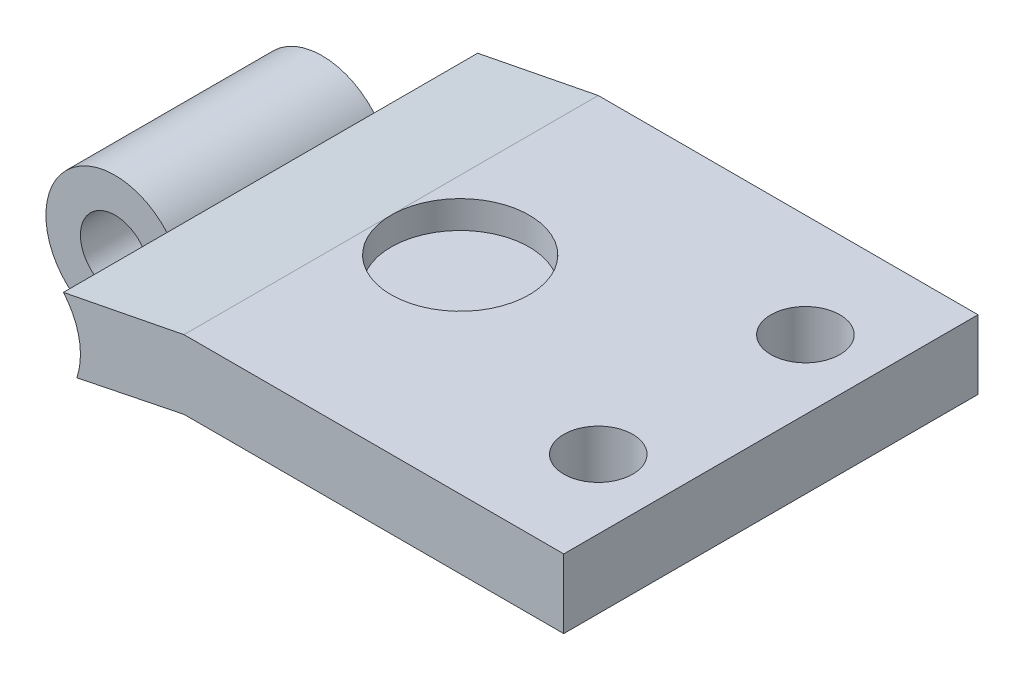
from build123d import *

# Parameters (mm, degrees)
Y_KSEKLIK_EKSTR_ZYON1_DEPTH = 30
KES_EKSTR_ZYON1_START       = -30
IZIM2_R                     = 2.5
KES_EKSTR_ZYON1_DEPTH       = 30
KES_EKSTR_ZYON3_START       = -7.5
IZIM6_R                     = 5
KES_EKSTR_ZYON3_DEPTH       = 7.5
IZIM7_R                     = 5
KES_EKSTR_ZYON4_DEPTH       = 7.5
IZIM9_R                     = 5
KES_EKSTR_ZYON6_DEPTH       = 2
IZIM10_R                    = 2.5
KES_EKSTR_ZYON7_DEPTH       = 5


with BuildPart() as part:
    # Çizim1 → Yükseklik-Ekstrüzyon1 (new body)
    with BuildSketch(Plane.XY):
        with BuildLine():
            Line((-25.050567114, 3.343092307), (-16.318399297, 5.056233526))
            Line((-16.318399297, 5.056233526), (3.922819568, 5.056233526))
            Line((3.922819568, 5.056233526), (6.182819568, 5.056233526))
            Line((6.182819568, 5.056233526), (11.182819568, 5.056233526))
            Line((11.182819568, 5.056233526), (11.182819568, 0.056233526))
            Line((11.182819568, 0.056233526), (6.182819568, 0.056233526))
            Line((6.182819568, 0.056233526), (3.922819568, 0.056233526))
            Line((3.922819568, 0.056233526), (-16.318399297, 0.056233526))
            Line((-16.318399297, 0.056233526), (-24.07574143, -1.527179355))
            ThreePointArc((-24.07574143, -1.527179355), (-33.721153292, -0.925093769), (-25.050567114, 3.343092307))
        make_face()
        with BuildLine():
            Line((-28.337105741, -2.397000362), (-28.299750993, -2.389375587))
            ThreePointArc((-28.299750993, -2.389375587), (-28.318413832, -2.393259183), (-28.337105741, -2.397000362))
        make_face(mode=Mode.SUBTRACT)
    extrude(amount=Y_KSEKLIK_EKSTR_ZYON1_DEPTH)

    # Çizim2 → Kes-Ekstrüzyon1 (cut)
    with BuildSketch(Plane.XY.offset(30).offset(KES_EKSTR_ZYON1_START)):
        with Locations((-28.818399297, 0.056233526)):
            Circle(IZIM2_R)
    extrude(amount=KES_EKSTR_ZYON1_DEPTH, mode=Mode.SUBTRACT)

    # Çizim6 → Kes-Ekstrüzyon3 (cut)
    with BuildSketch(Plane.XY.offset(30).offset(KES_EKSTR_ZYON3_START)):
        with Locations((-28.818399297, 0.056233526)):
            Circle(IZIM6_R)
    extrude(amount=KES_EKSTR_ZYON3_DEPTH, mode=Mode.SUBTRACT)

    # Çizim7 → Kes-Ekstrüzyon4 (cut)
    with BuildSketch(Plane(origin=(0, 0, 0), x_dir=(-1, 0, 0), z_dir=(0, 0, -1))):
        with Locations((28.818399297, 0.056233526)):
            Circle(IZIM7_R)
    extrude(amount=-KES_EKSTR_ZYON4_DEPTH, mode=Mode.SUBTRACT)

    # Çizim9 → Kes-Ekstrüzyon6 (cut)
    with BuildSketch(Plane(origin=(0, 5.056233526, 0), x_dir=(1, 0, 0), z_dir=(0, 1, 0))):
        with Locations(Location((-11.317180432, -15, 0), (0, 0, 270))):
            Circle(IZIM9_R)
    extrude(amount=-KES_EKSTR_ZYON6_DEPTH, mode=Mode.SUBTRACT)

    # Çizim10 → Kes-Ekstrüzyon7 (cut)
    with BuildSketch(Plane(origin=(0, 5.056233526, 0), x_dir=(1, 0, 0), z_dir=(0, 1, 0))):
        with Locations(Location((6.182819568, -22.5, 0), (0, 0, 270))):
            Circle(IZIM10_R)
        with Locations(Location((6.182819568, -7.5, 0), (0, 0, 270))):
            Circle(IZIM10_R)
    extrude(amount=-KES_EKSTR_ZYON7_DEPTH, mode=Mode.SUBTRACT)


solid = part.part
